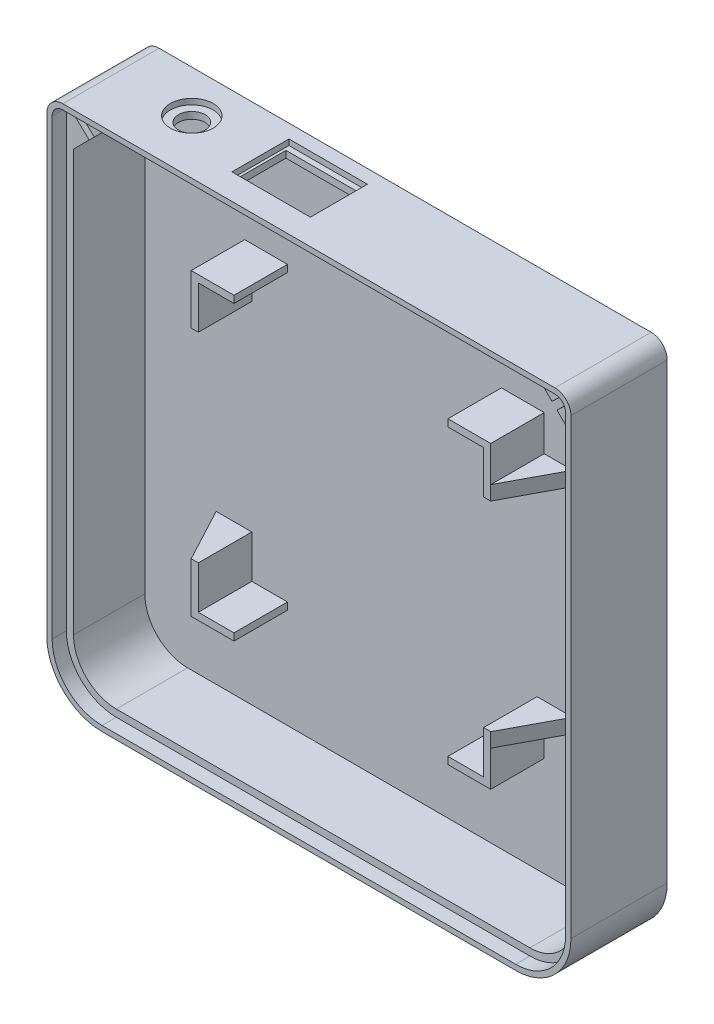
from build123d import *

# Parameters (mm, degrees)
BOSS_EXTRUDE1_DEPTH = 3
BOSS_EXTRUDE2_DEPTH = 20
CHAMFER1_SIZE       = 10
SKETCH3_W           = 84
SKETCH3_H           = 84
SKETCH3_W_2         = 80
SKETCH3_H_2         = 80
BOSS_EXTRUDE3_DEPTH = 15
BOSS_EXTRUDE4_DEPTH = 84
SKETCH7_W           = 8
SKETCH7_H           = 10
SKETCH7_H_2         = 56
SKETCH7_W_2         = 60
SKETCH7_H_3         = 84
CUT_EXTRUDE1_DEPTH  = 72
FILLET1_R           = 3
BOSS_EXTRUDE5_DEPTH = 27
SKETCH10_R          = 3.75
CUT_EXTRUDE2_DEPTH  = 26
CUT_EXTRUDE3_DEPTH  = 5
SKETCH12_R          = 1
CUT_EXTRUDE4_DEPTH  = 33
SKETCH14_R          = 6
CUT_EXTRUDE5_DEPTH  = 1.6
SKETCH15_W          = 20.5
SKETCH15_H          = 12.8
CUT_EXTRUDE6_DEPTH  = 9.6
SKETCH16_W          = 22
SKETCH16_H          = 16
CUT_EXTRUDE7_DEPTH  = 1.6
SKETCH18_W          = 84
SKETCH18_H          = 56
CUT_EXTRUDE8_DEPTH  = 15


with BuildPart() as part:
    # Sketch1 → Boss-Extrude1 (new body)
    with BuildSketch(Plane.XY):
        with BuildLine():
            Line((58, -72), (-58, -72))
            ThreePointArc((-58, -72), (-67.899494937, -67.899494937), (-72, -58))
            Line((-72, -58), (-72, 72))
            Line((-72, 72), (72, 72))
            Line((72, 72), (72, -58))
            ThreePointArc((72, -58), (67.899494937, -67.899494937), (58, -72))
        make_face()
    extrude(amount=BOSS_EXTRUDE1_DEPTH)

    # Sketch2 → Boss-Extrude2 (add)
    with BuildSketch(Plane.XY.offset(3)):
        with BuildLine():
            Line((-72, 72), (-72, -58))
            ThreePointArc((-72, -58), (-67.899494937, -67.899494937), (-58, -72))
            Line((-58, -72), (58, -72))
            ThreePointArc((58, -72), (67.899494937, -67.899494937), (72, -58))
            Line((72, -58), (72, 72))
            Line((72, 72), (-72, 72))
        make_face()
        with BuildLine():
            Line((-70, 70), (-70, -58))
            ThreePointArc((-70, -58), (-66.485281374, -66.485281374), (-58, -70))
            Line((-58, -70), (58, -70))
            ThreePointArc((58, -70), (66.485281374, -66.485281374), (70, -58))
            Line((70, -58), (70, 70))
            Line((70, 70), (-70, 70))
        make_face(mode=Mode.SUBTRACT)
    extrude(amount=BOSS_EXTRUDE2_DEPTH)

    # Chamfer1
    chamfer1_edges = [part.edges().sort_by_distance(p)[0] for p in [
        (-70, 70, 13),
        (70, 70, 13),
    ]]
    chamfer(chamfer1_edges, length=CHAMFER1_SIZE)

    # Sketch3 → Boss-Extrude3 (add)
    with BuildSketch(Plane.XY.offset(3)):
        Rectangle(SKETCH3_W, SKETCH3_H)
        Rectangle(SKETCH3_W_2, SKETCH3_H_2, mode=Mode.SUBTRACT)
    extrude(amount=BOSS_EXTRUDE3_DEPTH)

    # Sketch6 → Boss-Extrude4 (add)
    with BuildSketch(Plane.XZ.offset(42)):
        Polygon((-42, 3), (-50, 3), (-42, 18), align=None)
        Polygon((42, 18), (42, 3), (50, 3), align=None)
    extrude(amount=-BOSS_EXTRUDE4_DEPTH)

    # Sketch7 → Cut-Extrude1 (cut)
    with BuildSketch(Plane.XY.offset(3)):
        with Locations((-46, 37)):
            Rectangle(SKETCH7_W, SKETCH7_H)
        with Locations((-46, 0)):
            Rectangle(SKETCH7_W, SKETCH7_H_2)
        with Locations((-46, -37)):
            Rectangle(SKETCH7_W, SKETCH7_H)
        with Locations((46, -37)):
            Rectangle(SKETCH7_W, SKETCH7_H)
        with Locations((46, 0)):
            Rectangle(SKETCH7_W, SKETCH7_H_2)
        with Locations((46, 37)):
            Rectangle(SKETCH7_W, SKETCH7_H)
        Rectangle(SKETCH7_W_2, SKETCH7_H_3)
    extrude(amount=CUT_EXTRUDE1_DEPTH, mode=Mode.SUBTRACT)

    # Fillet1
    fillet1_edges = [part.edges().sort_by_distance(p)[0] for p in [
        (-72, 72, 11.5),
        (72, 72, 11.5),
    ]]
    fillet(fillet1_edges, radius=FILLET1_R)

    # Sketch9 → Boss-Extrude5 (add)
    with BuildSketch(Plane(origin=(0, 0, 0), x_dir=(-1, 0, 0), z_dir=(0, 0, -1))):
        with BuildLine():
            Line((73.5, -58), (73.5, 69))
            ThreePointArc((73.5, 69), (72.181980515, 72.181980515), (69, 73.5))
            Line((69, 73.5), (-69, 73.5))
            ThreePointArc((-69, 73.5), (-72.181980515, 72.181980515), (-73.5, 69))
            Line((-73.5, 69), (-73.5, -58))
            ThreePointArc((-73.5, -58), (-68.960155108, -68.960155108), (-58, -73.5))
            Line((-58, -73.5), (58, -73.5))
            ThreePointArc((58, -73.5), (68.960155108, -68.960155108), (73.5, -58))
        make_face()
        with BuildLine():
            Line((72, -58), (72, 69))
            ThreePointArc((72, 69), (71.121320344, 71.121320344), (69, 72))
            Line((69, 72), (-69, 72))
            ThreePointArc((-69, 72), (-71.121320344, 71.121320344), (-72, 69))
            Line((-72, 69), (-72, -58))
            ThreePointArc((-72, -58), (-67.899494937, -67.899494937), (-58, -72))
            Line((-58, -72), (58, -72))
            ThreePointArc((58, -72), (67.899494937, -67.899494937), (72, -58))
        make_face(mode=Mode.SUBTRACT)
    extrude(amount=-BOSS_EXTRUDE5_DEPTH)

    # Sketch10 → Cut-Extrude2 (cut)
    with BuildSketch(Plane.XZ.offset(-70)):
        with Locations((-48, 11.832723103)):
            Circle(SKETCH10_R)
    extrude(amount=-CUT_EXTRUDE2_DEPTH, mode=Mode.SUBTRACT)

    # Sketch11 → Cut-Extrude3 (cut)
    with BuildSketch(Plane.XY.offset(23)):
        with BuildLine():
            Line((-69.688606392, 68.274864677), (-65.603988879, 64.396011121))
            Line((-65.603988879, 64.396011121), (-64.178908017, 65.821091983))
            Line((-64.178908017, 65.821091983), (-68.242386769, 69.652703755))
            ThreePointArc((-68.242386769, 69.652703755), (-69.689783022, 69.724016148), (-69.688606392, 68.274864677))
        make_face()
        with BuildLine():
            Line((64.178908017, 65.821091983), (65.603988879, 64.396011121))
            Line((65.603988879, 64.396011121), (69.688606392, 68.274864677))
            ThreePointArc((69.688606392, 68.274864677), (69.689783022, 69.724016148), (68.242386769, 69.652703755))
            Line((68.242386769, 69.652703755), (64.178908017, 65.821091983))
        make_face()
    extrude(amount=-CUT_EXTRUDE3_DEPTH, mode=Mode.SUBTRACT)

    # Sketch12 → Cut-Extrude4 (cut)
    with BuildSketch(Plane.XY.offset(18)):
        with Locations((-69, 69)):
            Circle(SKETCH12_R)
        with Locations((69, 69)):
            Circle(SKETCH12_R)
    extrude(amount=-CUT_EXTRUDE4_DEPTH, mode=Mode.SUBTRACT)

    # Sketch14 → Cut-Extrude5 (cut)
    with BuildSketch(Plane(origin=(0, 73.5, 0), x_dir=(1, 0, 0), z_dir=(0, 1, 0))):
        with Locations(Location((-48, -11.832723103, 0), (0, 0, 270))):
            Circle(SKETCH14_R)
    extrude(amount=-CUT_EXTRUDE5_DEPTH, mode=Mode.SUBTRACT)

    # Sketch15 → Cut-Extrude6 (cut)
    with BuildSketch(Plane(origin=(0, 73.5, 0), x_dir=(1, 0, 0), z_dir=(0, 1, 0))):
        with Locations((-17.75, -11.832723103)):
            Rectangle(SKETCH15_W, SKETCH15_H)
    extrude(amount=-CUT_EXTRUDE6_DEPTH, mode=Mode.SUBTRACT)

    # Sketch16 → Cut-Extrude7 (cut)
    with BuildSketch(Plane(origin=(0, 73.5, 0), x_dir=(1, 0, 0), z_dir=(0, 1, 0))):
        with Locations((-17.75, -11.832723103)):
            Rectangle(SKETCH16_W, SKETCH16_H)
    extrude(amount=-CUT_EXTRUDE7_DEPTH, mode=Mode.SUBTRACT)

    # Sketch18 → Cut-Extrude8 (cut)
    with BuildSketch(Plane.XY.offset(18)):
        Rectangle(SKETCH18_W, SKETCH18_H)
    extrude(amount=-CUT_EXTRUDE8_DEPTH, mode=Mode.SUBTRACT)


solid = part.part
